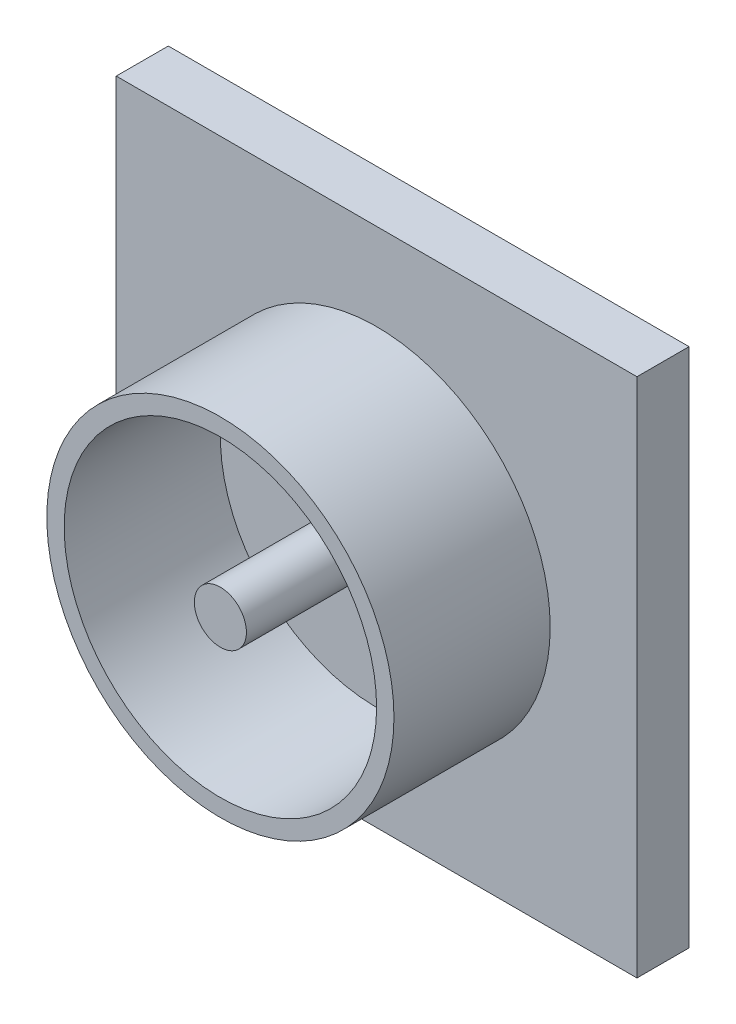
from build123d import *

# Parameters (mm, degrees)
CROQUIS1_W              = 3
CROQUIS1_H              = 3
SALIENTE_EXTRUIR1_DEPTH = 0.3
CROQUIS2_R              = 1
CROQUIS2_R_2            = 0.9
CROQUIS2_R_3            = 0.15
SALIENTE_EXTRUIR2_DEPTH = 0.9


with BuildPart() as part:
    # Croquis1 → Saliente-Extruir1 (new body)
    with BuildSketch(Plane.XY):
        Rectangle(CROQUIS1_W, CROQUIS1_H)
    extrude(amount=SALIENTE_EXTRUIR1_DEPTH)

    # Croquis2 → Saliente-Extruir2 (add)
    # profile 1 of 2: a face of its own
    with BuildSketch(Plane.XY.offset(0.3)):
        Circle(CROQUIS2_R)
        Circle(CROQUIS2_R_2, mode=Mode.SUBTRACT)
    # profile 2 of 2: a face of its own
    with BuildSketch(Plane.XY.offset(0.3)):
        Circle(CROQUIS2_R_3)
    extrude(amount=SALIENTE_EXTRUIR2_DEPTH)


solid = part.part
